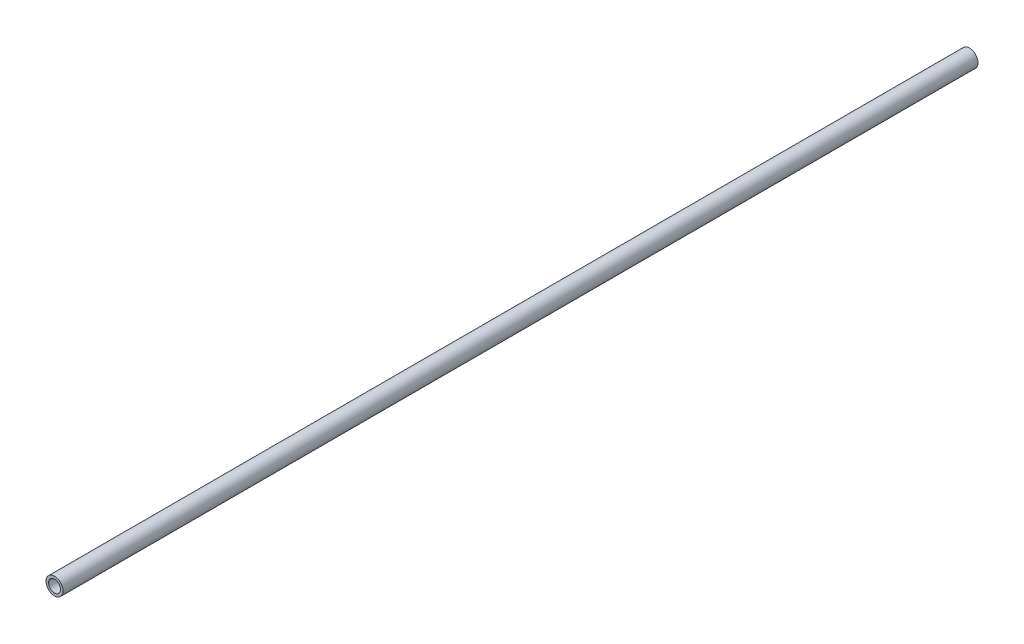
from build123d import *

# Parameters (mm, degrees)
SKETCH1_R           = 15.875
SKETCH1_R_2         = 11.1
BOSS_EXTRUDE1_DEPTH = 1700


with BuildPart() as part:
    # Sketch1 → Boss-Extrude1 (new body)
    with BuildSketch(Plane(origin=(0, 0, 0), x_dir=(0, 1, 0), z_dir=(0, 0, 1))):
        with Locations(Location((0, 0, 0), (0, 0, 270))):
            Circle(SKETCH1_R)
        with Locations(Location((0, 0, 0), (0, 0, 270))):
            Circle(SKETCH1_R_2, mode=Mode.SUBTRACT)
    extrude(amount=BOSS_EXTRUDE1_DEPTH)


solid = part.part
